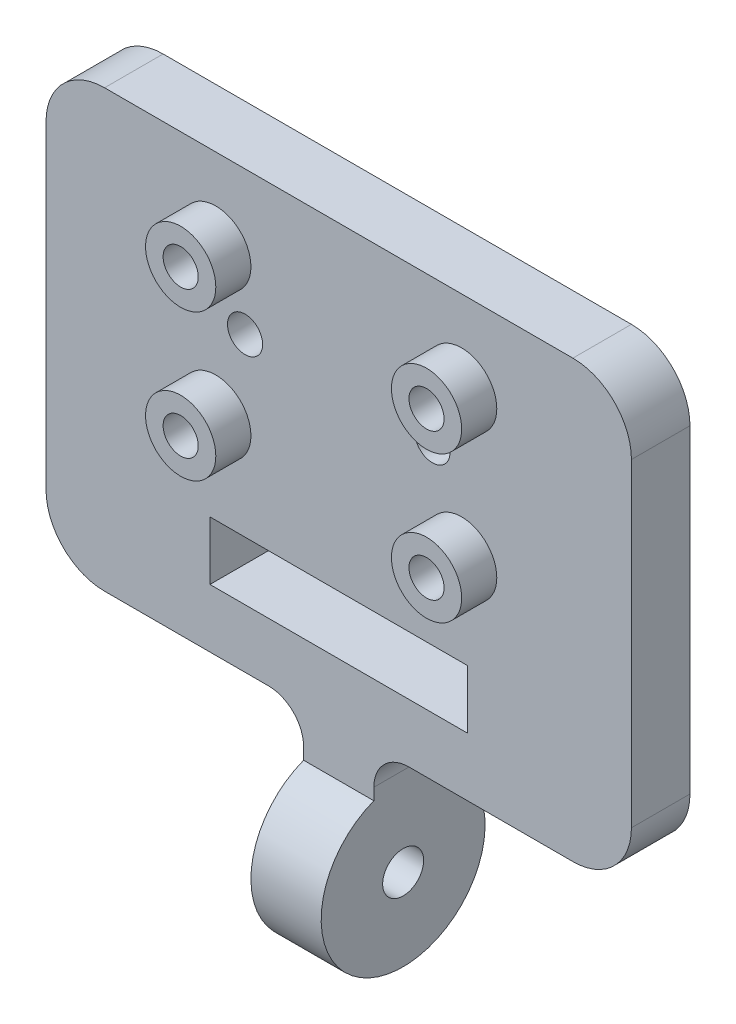
from build123d import *

# Parameters (mm, degrees)
ESQUISSE1_W                     = 50
ESQUISSE1_H                     = 48
BOSS_EXTRU_1_DEPTH              = 5
ESQUISSE2_R                     = 3
ESQUISSE2_R_2                   = 1.5
BOSS_EXTRU_2_DEPTH              = 3
R_P_TITION_LIN_AIRE1_COUNT      = 2
R_P_TITION_LIN_AIRE1_PITCH      = 21
R_P_TITION_LIN_AIRE1_COUNT_DIR2 = 2
R_P_TITION_LIN_AIRE1_PITCH_DIR2 = 12.5
ESQUISSE4_W                     = 6
ESQUISSE4_H                     = 5
BOSS_EXTRU_3_DEPTH              = 4
ESQUISSE5_R                     = 7
BOSS_EXTRU_4_DEPTH              = 6
ESQUISSE6_R                     = 1.75
ENL_V_MAT_EXTRU_1_DEPTH         = 6
ESQUISSE7_W                     = 50
ESQUISSE7_H                     = 10.758119029
ENL_V_MAT_EXTRU_2_DEPTH         = 10
CONG_2_R                        = 5
CONG_3_R                        = 3
ESQUISSE9_R                     = 1.5
ENL_V_MAT_EXTRU_3_DEPTH         = 70.161233188
ESQUISSE10_W                    = 22
ESQUISSE10_H                    = 5
ENL_V_MAT_EXTRU_4_DEPTH         = 10
ESQUISSE11_R                    = 3
BOSS_EXTRU_5_DEPTH              = 3
ESQUISSE12_R                    = 1.5
ENL_V_MAT_EXTRU_5_DEPTH         = 68.522412398


with BuildPart() as part:
    # Esquisse1 → Boss.-Extru.1 (new body)
    with BuildSketch(Plane.XY):
        with Locations((13.877005348, -12.235294118)):
            Rectangle(ESQUISSE1_W, ESQUISSE1_H)
    extrude(amount=BOSS_EXTRU_1_DEPTH)

    # Esquisse2 → Boss.-Extru.2 (add)
    with BuildSketch(Plane.XY.offset(5)):
        with Locations((3.377005348, -5.985294118)):
            Circle(ESQUISSE2_R)
        with Locations((3.377005348, -5.985294118)):
            Circle(ESQUISSE2_R_2, mode=Mode.SUBTRACT)
    boss_extru_2 = extrude(amount=BOSS_EXTRU_2_DEPTH)

    # Répétition linéaire1: Boss.-Extru.2 2 × 2
    with Locations(*[(i * R_P_TITION_LIN_AIRE1_PITCH, -j * R_P_TITION_LIN_AIRE1_PITCH_DIR2, 0) for i in range(R_P_TITION_LIN_AIRE1_COUNT) for j in range(R_P_TITION_LIN_AIRE1_COUNT_DIR2) if (i, j) != (0, 0)]):
        add(boss_extru_2)

    # Esquisse4 → Boss.-Extru.3 (add)
    with BuildSketch(Plane(origin=(0, -36.235294118, 0), x_dir=(-1, 0, 0), z_dir=(0, -1, 0))):
        with Locations((-13.877005348, -2.5)):
            Rectangle(ESQUISSE4_W, ESQUISSE4_H)
    extrude(amount=BOSS_EXTRU_3_DEPTH)

    # Esquisse5 → Boss.-Extru.4 (add)
    with BuildSketch(Plane.ZY.offset(-10.877005348)):
        with Locations((2.5, -46.773642533)):
            Circle(ESQUISSE5_R)
    extrude(amount=-BOSS_EXTRU_4_DEPTH)

    # Esquisse6 → Enlèv. mat.-Extru.1 (cut)
    with BuildSketch(Plane.ZY.offset(-10.877005348)):
        with Locations((2.5, -46.773642533)):
            Circle(ESQUISSE6_R)
    extrude(amount=-ENL_V_MAT_EXTRU_1_DEPTH, mode=Mode.SUBTRACT)

    # Esquisse7 → Enlèv. mat.-Extru.2 (cut)
    with BuildSketch(Plane.XY.offset(5)):
        with Locations((13.877005348, 6.385646368)):
            Rectangle(ESQUISSE7_W, ESQUISSE7_H)
    extrude(amount=-ENL_V_MAT_EXTRU_2_DEPTH, mode=Mode.SUBTRACT)

    # Congé2
    cong_2_edges = [part.edges().sort_by_distance(p)[0] for p in [
        (38.877005348, 1.006586853, 2.5),
        (-11.122994652, 1.006586853, 2.5),
        (38.877005348, -36.235294118, 2.5),
        (-11.122994652, -36.235294118, 2.5),
    ]]
    fillet(cong_2_edges, radius=CONG_2_R)

    # Congé3
    cong_3_edges = [part.edges().sort_by_distance(p)[0] for p in [
        (16.877005348, -36.235294118, 2.5),
        (10.877005348, -36.235294118, 2.5),
    ]]
    fillet(cong_3_edges, radius=CONG_3_R)

    # Esquisse9 → Enlèv. mat.-Extru.3 (cut, through all)
    with BuildSketch(Plane.XY.offset(15)):
        with Locations((3.377005348, -5.985294118)):
            Circle(ESQUISSE9_R)
        with Locations((24.377005348, -5.985294118)):
            Circle(ESQUISSE9_R)
        with Locations((24.377005348, -18.485294118)):
            Circle(ESQUISSE9_R)
        with Locations((3.377005348, -18.485294118)):
            Circle(ESQUISSE9_R)
    extrude(amount=-ENL_V_MAT_EXTRU_3_DEPTH, mode=Mode.SUBTRACT)

    # Esquisse10 → Enlèv. mat.-Extru.4 (cut)
    with BuildSketch(Plane.XY.offset(5)):
        with Locations((13.877005348, -28.735294118)):
            Rectangle(ESQUISSE10_W, ESQUISSE10_H)
    extrude(amount=-ENL_V_MAT_EXTRU_4_DEPTH, mode=Mode.SUBTRACT)

    # Esquisse11 → Boss.-Extru.5 (add)
    with BuildSketch(Plane(origin=(0, 0, 0), x_dir=(-1, 0, 0), z_dir=(0, 0, -1))):
        with Locations(Location((-21.877005348, -11.235294118, 0), (0, 0, 180))):
            Circle(ESQUISSE11_R)
        with Locations(Location((-5.877005348, -11.235294118, 0), (0, 0, 180))):
            Circle(ESQUISSE11_R)
    extrude(amount=BOSS_EXTRU_5_DEPTH)

    # Esquisse12 → Enlèv. mat.-Extru.5 (cut, through all)
    with BuildSketch(Plane(origin=(0, 0, -3), x_dir=(-1, 0, 0), z_dir=(0, 0, -1))):
        with Locations((-21.877005348, -11.235294118)):
            Circle(ESQUISSE12_R)
        with Locations((-5.877005348, -11.235294118)):
            Circle(ESQUISSE12_R)
    extrude(amount=-ENL_V_MAT_EXTRU_5_DEPTH, mode=Mode.SUBTRACT)


solid = part.part
